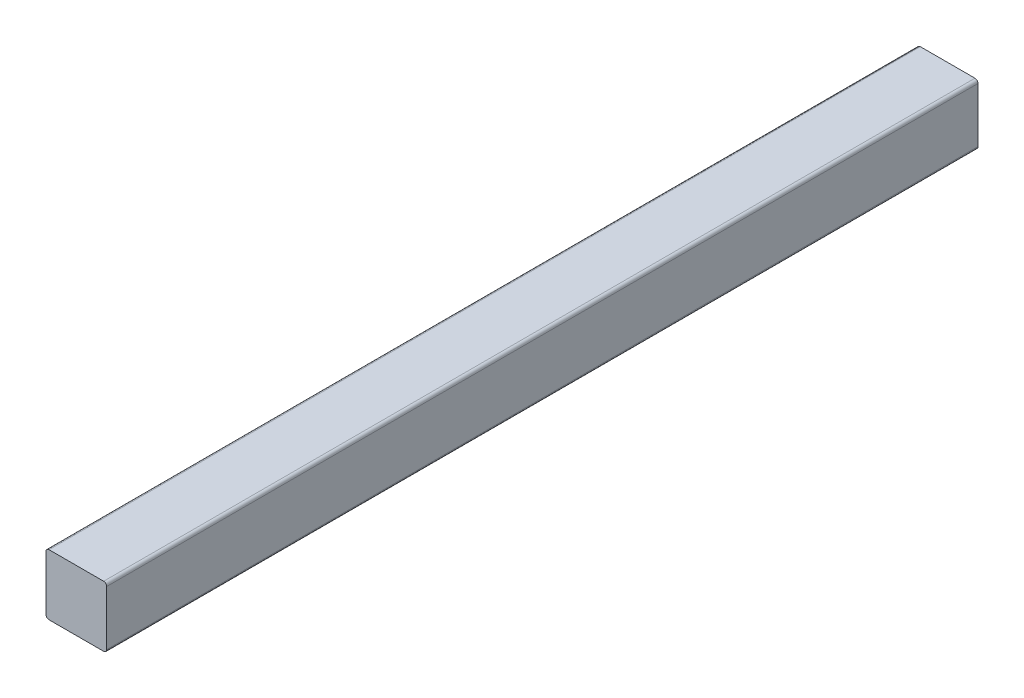
from build123d import *

# Parameters (mm, degrees)
SKETCH_1_W      = 20
SKETCH_1_H      = 20
EXTRUDE_1_DEPTH = 143.5
FILLET_1_R      = 1


with BuildPart() as part:
    # ｽｹｯﾁ1 → ﾎﾞｽ - 押し出し1 (new, symmetric)
    with BuildSketch(Plane.XY):
        Rectangle(SKETCH_1_W, SKETCH_1_H)
    extrude(amount=EXTRUDE_1_DEPTH, both=True)

    # ﾌｨﾚｯﾄ1
    fillet_1_edges = [part.edges().sort_by_distance(p)[0] for p in [
        (-10, 10, 0),
        (10, 10, 0),
        (10, -10, 0),
        (-10, -10, 0),
    ]]
    fillet(fillet_1_edges, radius=FILLET_1_R)


solid = part.part
